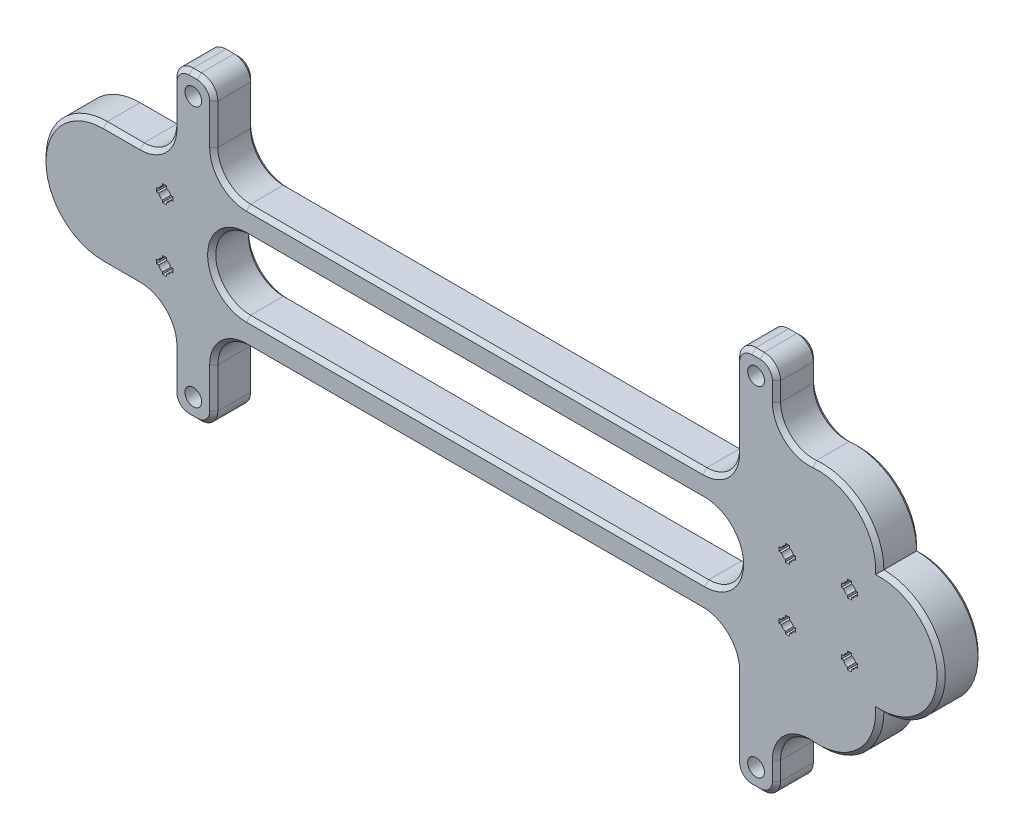
from build123d import *

# Parameters (mm, degrees)
SKETCH1_R           = 2.05
BOSS_EXTRUDE1_DEPTH = 10
FILLET2_R           = 8
FILLET3_R           = 4
CHAMFER1_SIZE       = 1
CHAMFER2_SIZE       = 1
CUT_EXTRUDE1_DEPTH  = 198.592359733
CHAMFER3_SIZE       = 1


with BuildPart() as part:
    # Sketch1 → Boss-Extrude1 (new body)
    with BuildSketch(Plane.XY):
        with BuildLine():
            Line((149.547980634, 18.349707709), (149.547980634, 38.825))
            Line((149.547980634, 38.825), (139.547980634, 38.825))
            Line((139.547980634, 38.825), (139.547980634, 7.4))
            Line((139.547980634, 7.4), (11.997980634, 7.4))
            Line((11.997980634, 7.4), (11.997980634, 29.225))
            Line((11.997980634, 29.225), (1.997980634, 29.225))
            Line((1.997980634, 29.225), (1.997980634, 7.4))
            Line((1.997980634, 7.4), (-15, 7.4))
            ThreePointArc((-15, 7.4), (-30, -7.6), (-15, -22.6))
            Line((-15, -22.6), (1.997980634, -22.6))
            Line((1.997980634, -22.6), (1.997980634, -44.425))
            Line((1.997980634, -44.425), (11.997980634, -44.425))
            Line((11.997980634, -44.425), (11.997980634, -22.6))
            Line((11.997980634, -22.6), (139.547980634, -22.6))
            Line((139.547980634, -22.6), (139.547980634, -54.025))
            Line((139.547980634, -54.025), (149.547980634, -54.025))
            Line((149.547980634, -54.025), (149.547980634, -33.549707709))
            ThreePointArc((149.547980634, -33.549707709), (165.767399329, -36.361909215), (174.8, -22.6))
            ThreePointArc((174.8, -22.6), (189.8, -7.6), (174.8, 7.4))
            ThreePointArc((174.8, 7.4), (165.767399329, 21.161909215), (149.547980634, 18.349707709))
        make_face()
        with BuildLine():
            Line((1.467140075, -14.7), (1.997980634, -14.7))
            Line((1.997980634, -14.7), (1.997980634, -15.7))
            Line((1.997980634, -15.7), (1.467140075, -15.7))
            ThreePointArc((1.467140075, -15.7), (1.096015511, -16.296015511), (0.5, -16.667140075))
            Line((0.5, -16.667140075), (0.5, -17.2))
            Line((0.5, -17.2), (-0.5, -17.2))
            Line((-0.5, -17.2), (-0.5, -16.667140075))
            ThreePointArc((-0.5, -16.667140075), (-1.096015511, -16.296015511), (-1.467140075, -15.7))
            Line((-1.467140075, -15.7), (-2, -15.7))
            Line((-2, -15.7), (-2, -14.7))
            Line((-2, -14.7), (-1.467140075, -14.7))
            ThreePointArc((-1.467140075, -14.7), (-1.096015511, -14.103984489), (-0.5, -13.732859925))
            Line((-0.5, -13.732859925), (-0.5, -13.2))
            Line((-0.5, -13.2), (0.5, -13.2))
            Line((0.5, -13.2), (0.5, -13.732859925))
            ThreePointArc((0.5, -13.732859925), (1.096015511, -14.103984489), (1.467140075, -14.7))
        make_face(mode=Mode.SUBTRACT)
        with BuildLine():
            Line((0.5, -2), (-0.5, -2))
            Line((-0.5, -2), (-0.5, -1.467140075))
            ThreePointArc((-0.5, -1.467140075), (-1.096015511, -1.096015511), (-1.467140075, -0.5))
            Line((-1.467140075, -0.5), (-2, -0.5))
            Line((-2, -0.5), (-2, 0.5))
            Line((-2, 0.5), (-1.467140075, 0.5))
            ThreePointArc((-1.467140075, 0.5), (-1.096015511, 1.096015511), (-0.5, 1.467140075))
            Line((-0.5, 1.467140075), (-0.5, 2))
            Line((-0.5, 2), (0.5, 2))
            Line((0.5, 2), (0.5, 1.467140075))
            ThreePointArc((0.5, 1.467140075), (1.096015511, 1.096015511), (1.467140075, 0.5))
            Line((1.467140075, 0.5), (1.997980634, 0.5))
            Line((1.997980634, 0.5), (1.997980634, -0.5))
            Line((1.997980634, -0.5), (1.467140075, -0.5))
            ThreePointArc((1.467140075, -0.5), (1.096015511, -1.096015511), (0.5, -1.467140075))
            Line((0.5, -1.467140075), (0.5, -2))
        make_face(mode=Mode.SUBTRACT)
        with Locations((144.547980634, 33.825)):
            Circle(SKETCH1_R, mode=Mode.SUBTRACT)
        with Locations((6.997980634, 24.225)):
            Circle(SKETCH1_R, mode=Mode.SUBTRACT)
        with BuildLine():
            Line((166.9, -2), (166.9, -1.467140075))
            ThreePointArc((166.9, -1.467140075), (166.303984489, -1.096015511), (165.932859925, -0.5))
            Line((165.932859925, -0.5), (165.4, -0.5))
            Line((165.4, -0.5), (165.4, 0.5))
            Line((165.4, 0.5), (165.932859925, 0.5))
            ThreePointArc((165.932859925, 0.5), (166.303984489, 1.096015511), (166.9, 1.467140075))
            Line((166.9, 1.467140075), (166.9, 2))
            Line((166.9, 2), (167.9, 2))
            Line((167.9, 2), (167.9, 1.467140075))
            ThreePointArc((167.9, 1.467140075), (168.496015511, 1.096015511), (168.867140075, 0.5))
            Line((168.867140075, 0.5), (169.4, 0.5))
            Line((169.4, 0.5), (169.4, -0.5))
            Line((169.4, -0.5), (168.867140075, -0.5))
            ThreePointArc((168.867140075, -0.5), (168.496015511, -1.096015511), (167.9, -1.467140075))
            Line((167.9, -1.467140075), (167.9, -2))
            Line((167.9, -2), (166.9, -2))
        make_face(mode=Mode.SUBTRACT)
        with BuildLine():
            Line((153.667140075, -14.7), (154.2, -14.7))
            Line((154.2, -14.7), (154.2, -15.7))
            Line((154.2, -15.7), (153.667140075, -15.7))
            ThreePointArc((153.667140075, -15.7), (153.296015511, -16.296015511), (152.7, -16.667140075))
            Line((152.7, -16.667140075), (152.7, -17.2))
            Line((152.7, -17.2), (151.7, -17.2))
            Line((151.7, -17.2), (151.7, -16.667140075))
            ThreePointArc((151.7, -16.667140075), (151.103984489, -16.296015511), (150.732859925, -15.7))
            Line((150.732859925, -15.7), (150.2, -15.7))
            Line((150.2, -15.7), (150.2, -14.7))
            Line((150.2, -14.7), (150.732859925, -14.7))
            ThreePointArc((150.732859925, -14.7), (151.103984489, -14.103984489), (151.7, -13.732859925))
            Line((151.7, -13.732859925), (151.7, -13.2))
            Line((151.7, -13.2), (152.7, -13.2))
            Line((152.7, -13.2), (152.7, -13.732859925))
            ThreePointArc((152.7, -13.732859925), (153.296015511, -14.103984489), (153.667140075, -14.7))
        make_face(mode=Mode.SUBTRACT)
        with BuildLine():
            Line((165.4, -15.7), (165.4, -14.7))
            Line((165.4, -14.7), (165.932859925, -14.7))
            ThreePointArc((165.932859925, -14.7), (166.303984489, -14.103984489), (166.9, -13.732859925))
            Line((166.9, -13.732859925), (166.9, -13.2))
            Line((166.9, -13.2), (167.9, -13.2))
            Line((167.9, -13.2), (167.9, -13.732859925))
            ThreePointArc((167.9, -13.732859925), (168.496015511, -14.103984489), (168.867140075, -14.7))
            Line((168.867140075, -14.7), (169.4, -14.7))
            Line((169.4, -14.7), (169.4, -15.7))
            Line((169.4, -15.7), (168.867140075, -15.7))
            ThreePointArc((168.867140075, -15.7), (168.496015511, -16.296015511), (167.9, -16.667140075))
            Line((167.9, -16.667140075), (167.9, -17.2))
            Line((167.9, -17.2), (166.9, -17.2))
            Line((166.9, -17.2), (166.9, -16.667140075))
            ThreePointArc((166.9, -16.667140075), (166.303984489, -16.296015511), (165.932859925, -15.7))
            Line((165.932859925, -15.7), (165.4, -15.7))
        make_face(mode=Mode.SUBTRACT)
        with BuildLine():
            Line((154.2, 0.5), (154.2, -0.5))
            Line((154.2, -0.5), (153.667140075, -0.5))
            ThreePointArc((153.667140075, -0.5), (153.296015511, -1.096015511), (152.7, -1.467140075))
            Line((152.7, -1.467140075), (152.7, -2))
            Line((152.7, -2), (151.7, -2))
            Line((151.7, -2), (151.7, -1.467140075))
            ThreePointArc((151.7, -1.467140075), (151.103984489, -1.096015511), (150.732859925, -0.5))
            Line((150.732859925, -0.5), (150.2, -0.5))
            Line((150.2, -0.5), (150.2, 0.5))
            Line((150.2, 0.5), (150.732859925, 0.5))
            ThreePointArc((150.732859925, 0.5), (151.103984489, 1.096015511), (151.7, 1.467140075))
            Line((151.7, 1.467140075), (151.7, 2))
            Line((151.7, 2), (152.7, 2))
            Line((152.7, 2), (152.7, 1.467140075))
            ThreePointArc((152.7, 1.467140075), (153.296015511, 1.096015511), (153.667140075, 0.5))
            Line((153.667140075, 0.5), (154.2, 0.5))
        make_face(mode=Mode.SUBTRACT)
        with Locations((6.997980634, -39.425)):
            Circle(SKETCH1_R, mode=Mode.SUBTRACT)
        with Locations((144.547980634, -49.025)):
            Circle(SKETCH1_R, mode=Mode.SUBTRACT)
    extrude(amount=BOSS_EXTRUDE1_DEPTH)

    # Fillet2
    fillet2_edges = [part.edges().sort_by_distance(p)[0] for p in [
        (139.547980634, -22.6, 5),
        (11.997980634, -22.6, 5),
        (1.997980634, -22.6, 5),
        (1.997980634, 7.4, 5),
        (11.997980634, 7.4, 5),
        (139.547980634, 7.4, 5),
        (149.547980634, 18.349707709, 5),
        (149.547980634, -33.549707709, 5),
    ]]
    fillet(fillet2_edges, radius=FILLET2_R)

    # Fillet3
    fillet3_edges = [part.edges().sort_by_distance(p)[0] for p in [
        (149.547980634, -54.025, 5),
        (139.547980634, -54.025, 5),
        (11.997980634, -44.425, 5),
        (1.997980634, -44.425, 5),
        (1.997980634, 29.225, 5),
        (11.997980634, 29.225, 5),
        (139.547980634, 38.825, 5),
        (149.547980634, 38.825, 5),
    ]]
    fillet(fillet3_edges, radius=FILLET3_R)

    # Chamfer1
    chamfer1_edges = [part.edges().sort_by_distance(p)[0] for p in [
        (-10.501009683, -22.6, 0),
        (-30, -7.6, 0),
        (-10.501009683, 7.4, 0),
        (189.8, -7.6, 0),
        (169.873960884, -33.713744289, 0),
        (169.873960884, 18.513744289, 0),
        (75.772980634, 7.4, 0),
        (139.547980634, 25.1125, 0),
        (139.547980634, -40.3125, 0),
        (75.772980634, -22.6, 0),
        (1.997980634, -35.5125, 0),
        (1.997980634, 20.3125, 0),
        (152.175201496, -39.562152205, 0),
        (152.175201496, 24.362152205, 0),
        (137.204834883, 9.743145751, 0),
        (137.204834883, -24.943145751, 0),
        (-0.345165117, -24.943145751, 0),
        (14.341126384, -24.943145751, 0),
        (-0.345165117, 9.743145751, 0),
        (14.341126384, 9.743145751, 0),
        (149.547980634, -47.757241246, 0),
        (144.547980634, -54.025, 0),
        (11.997980634, -35.5125, 0),
        (6.997980634, -44.425, 0),
        (6.997980634, 29.225, 0),
        (11.997980634, 20.3125, 0),
        (144.547980634, 38.825, 0),
        (149.547980634, 32.557241246, 0),
        (148.376407759, 37.653427125, 0),
        (140.719553509, 37.653427125, 0),
        (148.376407759, -52.853427125, 0),
        (140.719553509, -52.853427125, 0),
        (10.826407759, -43.253427125, 0),
        (3.169553509, -43.253427125, 0),
        (10.826407759, 28.053427125, 0),
        (3.169553509, 28.053427125, 0),
    ]]
    chamfer(chamfer1_edges, length=CHAMFER1_SIZE)

    # Chamfer2
    chamfer2_edges = [part.edges().sort_by_distance(p)[0] for p in [
        (169.873960884, -33.713744289, 10),
        (189.8, -7.6, 10),
        (169.873960884, 18.513744289, 10),
        (75.772980634, 7.4, 10),
        (139.547980634, 25.1125, 10),
        (139.547980634, -40.3125, 10),
        (75.772980634, -22.6, 10),
        (1.997980634, -35.5125, 10),
        (1.997980634, 20.3125, 10),
        (152.175201496, -39.562152205, 10),
        (152.175201496, 24.362152205, 10),
        (137.204834883, 9.743145751, 10),
        (137.204834883, -24.943145751, 10),
        (-0.345165117, -24.943145751, 10),
        (14.341126384, -24.943145751, 10),
        (-0.345165117, 9.743145751, 10),
        (14.341126384, 9.743145751, 10),
        (6.997980634, 29.225, 10),
        (149.547980634, -47.757241246, 10),
        (149.547980634, 32.557241246, 10),
        (144.547980634, 38.825, 10),
        (11.997980634, 20.3125, 10),
        (6.997980634, -44.425, 10),
        (11.997980634, -35.5125, 10),
        (144.547980634, -54.025, 10),
        (148.376407759, 37.653427125, 10),
        (140.719553509, 37.653427125, 10),
        (148.376407759, -52.853427125, 10),
        (140.719553509, -52.853427125, 10),
        (10.826407759, -43.253427125, 10),
        (3.169553509, -43.253427125, 10),
        (10.826407759, 28.053427125, 10),
        (3.169553509, 28.053427125, 10),
        (-10.501009683, 7.4, 10),
        (-30, -7.6, 10),
        (-10.501009683, -22.6, 10),
    ]]
    chamfer(chamfer2_edges, length=CHAMFER2_SIZE)

    # Sketch2 → Cut-Extrude1 (cut, through all)
    with BuildSketch(Plane.XY.offset(10)):
        with BuildLine():
            Line((19.997980634, 0.9), (131.997980634, 0.9))
            ThreePointArc((131.997980634, 0.9), (140.497980634, -7.6), (131.997980634, -16.1))
            Line((131.997980634, -16.1), (19.997980634, -16.1))
            ThreePointArc((19.997980634, -16.1), (11.497980634, -7.6), (19.997980634, 0.9))
        make_face()
    extrude(amount=-CUT_EXTRUDE1_DEPTH, mode=Mode.SUBTRACT)

    # Chamfer3
    chamfer3_edges = [part.edges().sort_by_distance(p)[0] for p in [
        (11.497980634, -7.6, 0),
        (75.997980634, 0.9, 0),
        (140.497980634, -7.6, 0),
        (75.997980634, -16.1, 0),
        (11.497980634, -7.6, 10),
        (75.997980634, -16.1, 10),
        (140.497980634, -7.6, 10),
        (75.997980634, 0.9, 10),
    ]]
    chamfer(chamfer3_edges, length=CHAMFER3_SIZE)


solid = part.part
